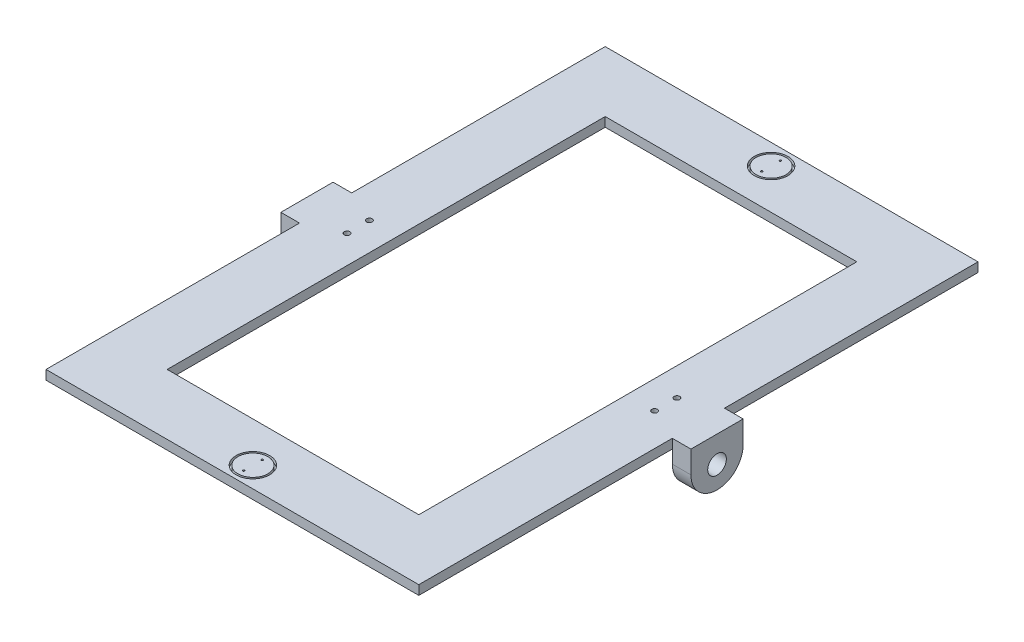
from build123d import *

# Parameters (mm, degrees)
SKETCH1_W           = 200
SKETCH1_H           = 300
SKETCH1_W_2         = 135
SKETCH1_H_2         = 235
BOSS_EXTRUDE1_DEPTH = 5
SKETCH3_R           = 5
BOSS_EXTRUDE2_DEPTH = 10
SKETCH4_R           = 9
SKETCH4_R_2         = 8
CUT_EXTRUDE1_DEPTH  = 2
SKETCH5_R           = 0.5
CUT_EXTRUDE2_DEPTH  = 5
SKETCH6_R           = 1.5
CUT_EXTRUDE3_DEPTH  = 5


with BuildPart() as part:
    # Sketch1 → Boss-Extrude1 (new body)
    with BuildSketch(Plane(origin=(0, 0, 0), x_dir=(1, 0, 0), z_dir=(0, 1, 0))):
        Rectangle(SKETCH1_W, SKETCH1_H)
        Rectangle(SKETCH1_W_2, SKETCH1_H_2, mode=Mode.SUBTRACT)
    extrude(amount=BOSS_EXTRUDE1_DEPTH)

    # Sketch3 → Boss-Extrude2 (add)
    with BuildSketch(Plane(origin=(100, 0, 0), x_dir=(0, 0, -1), z_dir=(1, 0, 0))):
        with BuildLine():
            Line((-14, 5), (14, 5))
            Line((14, 5), (14, -7))
            ThreePointArc((14, -7), (0, -21.000001209), (-14, -7))
            Line((-14, -7), (-14, 5))
        make_face()
        with Locations((0, -9.127388195)):
            Circle(SKETCH3_R, mode=Mode.SUBTRACT)
    boss_extrude2 = extrude(amount=BOSS_EXTRUDE2_DEPTH)

    # Mirror1: Boss-Extrude2 across plane
    add(boss_extrude2.mirror(Plane(origin=(0, 0, 0), x_dir=(0, 0, 1), z_dir=(1, 0, 0))))

    # Sketch4 → Cut-Extrude1 (cut)
    with BuildSketch(Plane(origin=(0, 5, 0), x_dir=(1, 0, 0), z_dir=(0, 1, 0))):
        with Locations(Location((0, -139, 0), (0, 0, 270))):
            Circle(SKETCH4_R)
        with Locations(Location((0, -139, 0), (0, 0, 270))):
            Circle(SKETCH4_R_2, mode=Mode.SUBTRACT)
    cut_extrude1 = extrude(amount=-CUT_EXTRUDE1_DEPTH, mode=Mode.SUBTRACT)

    # Mirror2: Cut-Extrude1 across plane
    add(cut_extrude1.mirror(Plane.XY), mode=Mode.SUBTRACT)

    # Sketch5 → Cut-Extrude2 (cut)
    with BuildSketch(Plane(origin=(0, 5, 0), x_dir=(1, 0, 0), z_dir=(0, 1, 0))):
        with Locations(Location((0, -134, 0), (0, 0, 270))):
            Circle(SKETCH5_R)
        with Locations(Location((0, -144, 0), (0, 0, 270))):
            Circle(SKETCH5_R)
    cut_extrude2 = extrude(amount=-CUT_EXTRUDE2_DEPTH, mode=Mode.SUBTRACT)

    # Mirror3: Cut-Extrude2 across plane
    add(cut_extrude2.mirror(Plane.XY), mode=Mode.SUBTRACT)

    # Sketch6 → Cut-Extrude3 (cut)
    with BuildSketch(Plane(origin=(0, 5, 0), x_dir=(1, 0, 0), z_dir=(0, 1, 0))):
        with Locations(Location((-82.5, 6, 0), (0, 0, 270))):
            Circle(SKETCH6_R)
        with Locations(Location((-82.5, -6, 0), (0, 0, 270))):
            Circle(SKETCH6_R)
    cut_extrude3 = extrude(amount=-CUT_EXTRUDE3_DEPTH, mode=Mode.SUBTRACT)

    # Mirror4: Cut-Extrude3 across plane
    add(cut_extrude3.mirror(Plane(origin=(0, 0, 0), x_dir=(0, 0, 1), z_dir=(1, 0, 0))), mode=Mode.SUBTRACT)


solid = part.part
